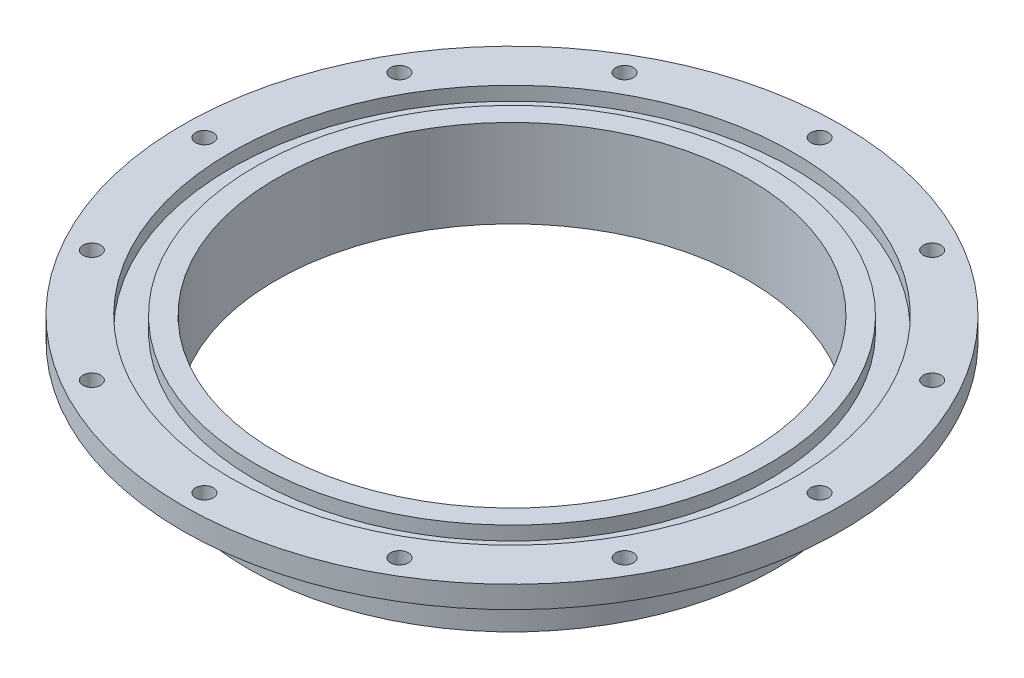
from build123d import *

# Parameters (mm, degrees)
SKETCH1_R               = 76.2
SKETCH1_R_2             = 68.2625
INNER_CYLINDER_DEPTH    = 19.05
SKETCH2_R               = 95.25
SKETCH2_R_2             = 68.2625
FLANGE_DEPTH            = 6.35
SKETCH4_R               = 81.407
SKETCH4_R_2             = 74.295
GROOVE_DEPTH            = 3.9878
SKETCH5_R               = 2.5527
SCREW_HOLES_DEPTH       = 6.35
CIRPATTERN1_COUNT       = 12
CUT_EXTRUDE1_DEPTH      = 3.6068
CUT_EXTRUDE1_DEPTH_BACK = 3.6068
SKETCH7_R               = 76.2
SKETCH7_R_2             = 71.8566


with BuildPart() as part:
    # Sketch1 → Inner Cylinder (new body)
    with BuildSketch(Plane(origin=(0, 0, 0), x_dir=(1, 0, 0), z_dir=(0, 1, 0))):
        with Locations(Location((0, 0, 0), (0, 0, 90))):
            Circle(SKETCH1_R)
        with Locations(Location((0, 0, 0), (0, 0, 90))):
            Circle(SKETCH1_R_2, mode=Mode.SUBTRACT)
    extrude(amount=INNER_CYLINDER_DEPTH)

    # Sketch2 → Flange (add)
    with BuildSketch(Plane(origin=(0, 19.05, 0), x_dir=(1, 0, 0), z_dir=(0, 1, 0))):
        with Locations(Location((0, 0, 0), (0, 0, 270))):
            Circle(SKETCH2_R)
        with Locations(Location((0, 0, 0), (0, 0, 90))):
            Circle(SKETCH2_R_2, mode=Mode.SUBTRACT)
    extrude(amount=FLANGE_DEPTH)

    # Sketch4 → Groove (cut)
    with BuildSketch(Plane(origin=(0, 25.4, 0), x_dir=(1, 0, 0), z_dir=(0, 1, 0))):
        with Locations(Location((0, 0, 0), (0, 0, 270))):
            Circle(SKETCH4_R)
        with Locations(Location((0, 0, 0), (0, 0, 270))):
            Circle(SKETCH4_R_2, mode=Mode.SUBTRACT)
    extrude(amount=-GROOVE_DEPTH, mode=Mode.SUBTRACT)

    # Sketch5 → Screw Holes (cut)
    with BuildSketch(Plane(origin=(0, 25.4, 0), x_dir=(1, 0, 0), z_dir=(0, 1, 0))):
        with Locations(Location((0, -88.9, 0), (0, 0, 270))):
            Circle(SKETCH5_R)
    screw_holes = extrude(amount=-SCREW_HOLES_DEPTH, mode=Mode.SUBTRACT)

    # CirPattern1: Screw Holes ×12 about axis
    cirpattern1_axis = Axis((0, 0, 0), (0, 1, 0))
    for i in range(1, CIRPATTERN1_COUNT):
        add(screw_holes.rotate(cirpattern1_axis, i * 360 / CIRPATTERN1_COUNT), mode=Mode.SUBTRACT)

    # Sketch7 → Cut-Extrude1 (cut, two sides: drawn at the far end of the back side and taken through both)
    with BuildSketch(Plane(origin=(0, 9.525, 0), x_dir=(-1, 0, 0), z_dir=(0, -1, 0)).offset(-CUT_EXTRUDE1_DEPTH_BACK)):
        with Locations(Location((0, 0, 0), (0, 0, 90))):
            Circle(SKETCH7_R)
        with Locations(Location((0, 0, 0), (0, 0, 90))):
            Circle(SKETCH7_R_2, mode=Mode.SUBTRACT)
    extrude(amount=CUT_EXTRUDE1_DEPTH + CUT_EXTRUDE1_DEPTH_BACK, mode=Mode.SUBTRACT)


solid = part.part
